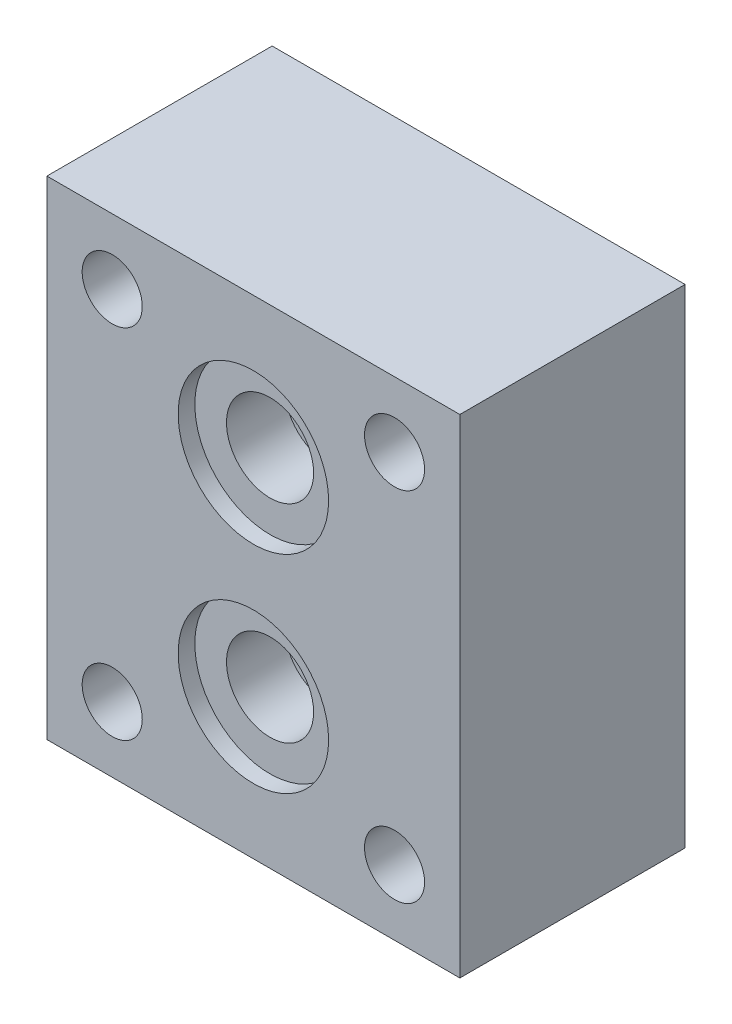
from build123d import *

# Parameters (mm, degrees)
SKETCH1_W           = 82.55
SKETCH1_H           = 69.85
BOSS_EXTRUDE1_DEPTH = 19.05
CUT_EXTRUDE2_START  = 19.05
SKETCH2_R           = 5.08
CUT_EXTRUDE2_DEPTH  = 77.376117521
CUT_EXTRUDE4_START  = 19.05
SKETCH3_R           = 5.08
CUT_EXTRUDE4_DEPTH  = 77.376117521
CUT_EXTRUDE6_START  = 19.05
SKETCH4_R           = 7.366
CUT_EXTRUDE6_DEPTH  = 12.7
CUT_EXTRUDE8_START  = 19.05
SKETCH5_R           = 12.7254
CUT_EXTRUDE8_DEPTH  = 2.8194
CUT_EXTRUDE10_START = 19.05
SKETCH6_R           = 7.366
CUT_EXTRUDE10_DEPTH = 12.7
CUT_EXTRUDE12_START = 19.05
SKETCH7_R           = 12.7254
CUT_EXTRUDE12_DEPTH = 2.8194


with BuildPart() as part:
    # Sketch1 → Boss-Extrude1 (new, symmetric)
    with BuildSketch(Plane(origin=(0, 0, 0), x_dir=(0, 1, 0), z_dir=(0, 0, 1))):
        Rectangle(SKETCH1_W, SKETCH1_H)
    extrude(amount=BOSS_EXTRUDE1_DEPTH, both=True)

    # Sketch2 → Cut-Extrude2 (cut, through all)
    with BuildSketch(Plane(origin=(0, 0, 0), x_dir=(0, 1, 0), z_dir=(0, 0, 1)).offset(CUT_EXTRUDE2_START)):
        with Locations(Location((-30.226, -23.876, 0), (0, 0, 270))):
            Circle(SKETCH2_R)
    extrude(amount=-CUT_EXTRUDE2_DEPTH, mode=Mode.SUBTRACT)

    # Sketch3 → Cut-Extrude4 (cut, through all)
    with BuildSketch(Plane(origin=(0, 0, 0), x_dir=(0, 1, 0), z_dir=(0, 0, 1)).offset(CUT_EXTRUDE4_START)):
        with Locations(Location((30.226, -23.876, 0), (0, 0, 270))):
            Circle(SKETCH3_R)
        with Locations(Location((-30.226, 23.876, 0), (0, 0, 270))):
            Circle(SKETCH3_R)
        with Locations(Location((30.226, 23.876, 0), (0, 0, 270))):
            Circle(SKETCH3_R)
    extrude(amount=-CUT_EXTRUDE4_DEPTH, mode=Mode.SUBTRACT)

    # Sketch4 → Cut-Extrude6 (cut)
    with BuildSketch(Plane(origin=(0, 0, 0), x_dir=(0, 1, 0), z_dir=(0, 0, 1)).offset(CUT_EXTRUDE6_START)):
        with Locations(Location((-17.526, 0, 0), (0, 0, 270))):
            Circle(SKETCH4_R)
    extrude(amount=-CUT_EXTRUDE6_DEPTH, mode=Mode.SUBTRACT)

    # Sketch5 → Cut-Extrude8 (cut)
    with BuildSketch(Plane(origin=(0, 0, 0), x_dir=(0, 1, 0), z_dir=(0, 0, 1)).offset(CUT_EXTRUDE8_START)):
        with Locations(Location((-17.526, 0, 0), (0, 0, 270))):
            Circle(SKETCH5_R)
    extrude(amount=-CUT_EXTRUDE8_DEPTH, mode=Mode.SUBTRACT)

    # Sketch6 → Cut-Extrude10 (cut)
    with BuildSketch(Plane(origin=(0, 0, 0), x_dir=(0, 1, 0), z_dir=(0, 0, 1)).offset(CUT_EXTRUDE10_START)):
        with Locations(Location((17.526, 0, 0), (0, 0, 270))):
            Circle(SKETCH6_R)
    extrude(amount=-CUT_EXTRUDE10_DEPTH, mode=Mode.SUBTRACT)

    # Sketch7 → Cut-Extrude12 (cut)
    with BuildSketch(Plane(origin=(0, 0, 0), x_dir=(0, 1, 0), z_dir=(0, 0, 1)).offset(CUT_EXTRUDE12_START)):
        with Locations(Location((17.526, 0, 0), (0, 0, 270))):
            Circle(SKETCH7_R)
    extrude(amount=-CUT_EXTRUDE12_DEPTH, mode=Mode.SUBTRACT)


solid = part.part
